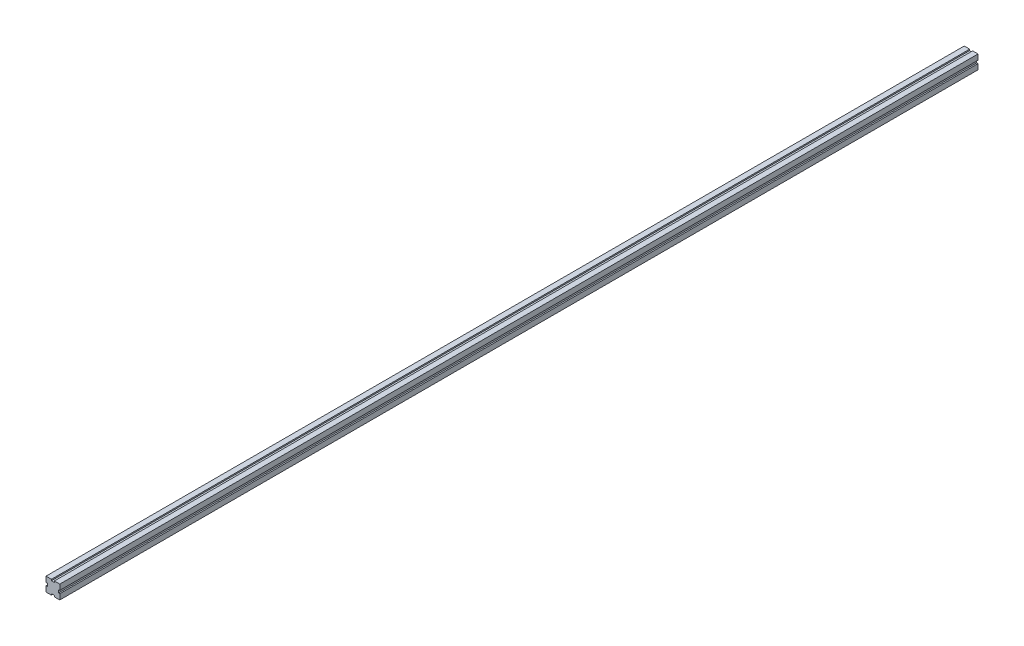
from build123d import *

# Parameters (mm, degrees)
BOSS_EXTRUDE1_DEPTH = 1000


with BuildPart() as part:
    # ob profile → Boss-Extrude1 (new body)
    with BuildSketch(Plane.XY):
        Polygon((-7.5, 7.5), (-1.6, 7.5), (-1.6, 6.1), (1.6, 6.1), (1.6, 7.5), (4.4, 7.5), (7.5, 7.5), (7.5, 1.6), (6.1, 1.6), (6.1, -1.6), (7.5, -1.6), (7.5, -7.5), (1.6, -7.5), (1.6, -6.1), (-1.6, -6.1), (-1.6, -7.5), (-7.5, -7.5), (-7.5, -1.6), (-6.1, -1.6), (-6.1, 1.6), (-7.5, 1.6), align=None)
    extrude(amount=BOSS_EXTRUDE1_DEPTH)


solid = part.part
